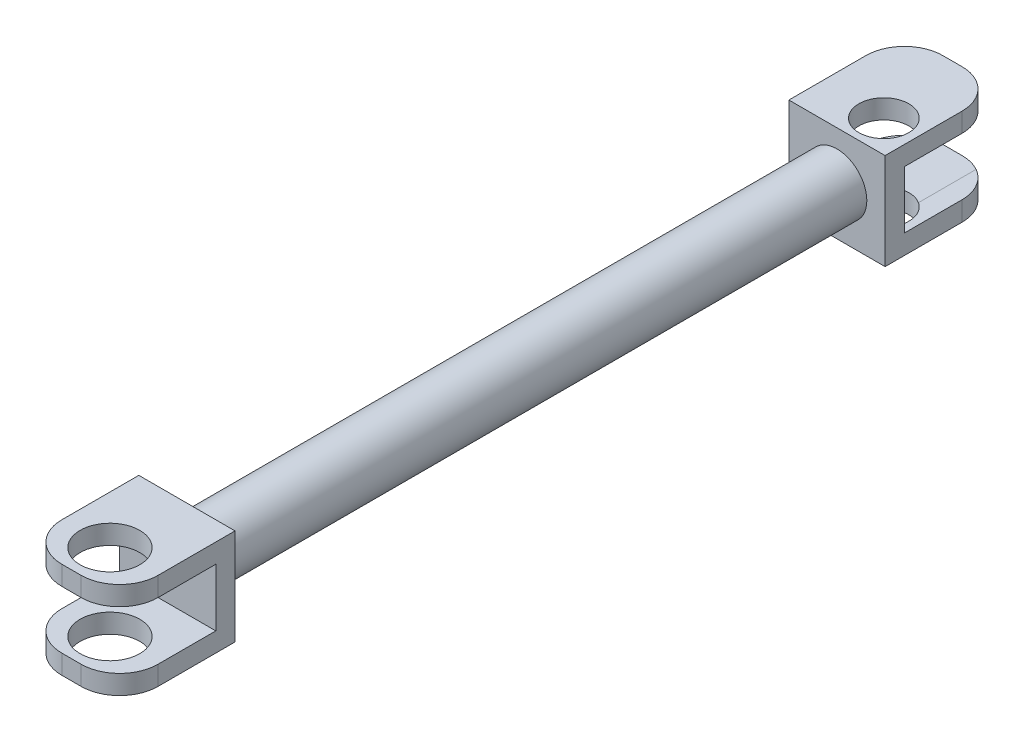
from build123d import *

# Parameters (mm, degrees)
SKETCH1_W             = 50
SKETCH1_H             = 50
BOSS_EXTRUDE1_DEPTH   = 10
BOSS_EXTRUDE1_2_DEPTH = 10
BOSS_EXTRUDE2_DEPTH   = 50
SKETCH3_W             = 30
SKETCH3_H             = 30
CUT_EXTRUDE1_DEPTH    = 90
SKETCH4_W             = 10
SKETCH4_H             = 29.860616381
SKETCH4_H_2           = 30
CUT_EXTRUDE2_DEPTH    = 90
SKETCH5_W             = 50
SKETCH5_H             = 50
BOSS_EXTRUDE3_DEPTH   = 10
SKETCH6_R             = 12
CUT_EXTRUDE3_DEPTH    = 80
SKETCH13_W            = 50
SKETCH13_H            = 50
CUT_EXTRUDE5_DEPTH    = 160
BOSS_EXTRUDE4_DEPTH   = 337.81
SKETCH14_W            = 50
SKETCH14_H            = 50
BOSS_EXTRUDE5_DEPTH   = 10
BOSS_EXTRUDE6_DEPTH   = 10
BOSS_EXTRUDE7_DEPTH   = 10
SKETCH17_R            = 15.5
CUT_EXTRUDE6_DEPTH    = 70
SKETCH19_R            = 12.7
CUT_EXTRUDE7_DEPTH    = 70
SKETCH20_R            = 12.7
BOSS_EXTRUDE11_DEPTH  = 10
SKETCH26_R            = 12
BOSS_EXTRUDE12_DEPTH  = 10
SKETCH27_R            = 13
CUT_EXTRUDE8_DEPTH    = 70


with BuildPart() as part:
    # Sketch1 → Boss-Extrude1 (new body)
    with BuildSketch(Plane.XY):
        with Locations((25, 25)):
            Rectangle(SKETCH1_W, SKETCH1_H)
    extrude(amount=BOSS_EXTRUDE1_DEPTH)

    # Sketch2 → Boss-Extrude2 (add)
    with BuildSketch(Plane(origin=(0, 0, 0), x_dir=(1, 0, 0), z_dir=(0, 1, 0))):
        with BuildLine():
            Line((0, 0), (50, 0))
            Line((50, 0), (50, 30))
            ThreePointArc((50, 30), (44.142135624, 44.142135624), (30, 50))
            Line((30, 50), (20, 50))
            ThreePointArc((20, 50), (5.857864376, 44.142135624), (0, 30))
            Line((0, 30), (0, 0))
        make_face()
    extrude(amount=BOSS_EXTRUDE2_DEPTH)

    # Sketch3 → Cut-Extrude1 (cut)
    with BuildSketch(Plane.XY.offset(10)):
        with Locations((25, 25)):
            Rectangle(SKETCH3_W, SKETCH3_H)
    extrude(amount=-CUT_EXTRUDE1_DEPTH, mode=Mode.SUBTRACT)

    # Sketch4 → Cut-Extrude2 (cut)
    with BuildSketch(Plane.XY.offset(10)):
        with Locations((45, 25.06969181)):
            Rectangle(SKETCH4_W, SKETCH4_H)
        with Locations((5, 25)):
            Rectangle(SKETCH4_W, SKETCH4_H_2)
    extrude(amount=-CUT_EXTRUDE2_DEPTH, mode=Mode.SUBTRACT)


with BuildPart() as body_2:
    # Sketch1 → Boss-Extrude1 2 (new body)
    with BuildSketch(Plane.XY):
        with Locations((25, -320)):
            Rectangle(SKETCH1_W, SKETCH1_H)
    extrude(amount=BOSS_EXTRUDE1_2_DEPTH)

    # Sketch13 → Cut-Extrude5 (cut)
    with BuildSketch(Plane(origin=(0, 0, 0), x_dir=(-1, 0, 0), z_dir=(0, 0, -1))):
        with Locations((-25, -320)):
            Rectangle(SKETCH13_W, SKETCH13_H)
    extrude(amount=-CUT_EXTRUDE5_DEPTH, mode=Mode.SUBTRACT)


with BuildPart() as cut_extrude2_piece_1:
    # of the separate pieces the step leaves, piece 1, a body of its own (cut_extrude2_pieces)
    add(part.part.solids().sort_by_distance((0, 0, 10))[0])



with BuildPart() as cut_extrude2_piece_2:
    # of the separate pieces the step leaves, piece 2, a body of its own (cut_extrude2_pieces)
    add(part.part.solids().sort_by_distance((0, 50, 10))[0])


with BuildPart() as cut_extrude2_piece_1_1:
    add(cut_extrude2_piece_1.part)

    add(cut_extrude2_piece_2.part)  # Boss-Extrude3 merges Cut-Extrude2 piece 2
    # Sketch5 → Boss-Extrude3 (add)
    with BuildSketch(Plane.XY.offset(10)):
        with Locations((25, 25)):
            Rectangle(SKETCH5_W, SKETCH5_H)
    extrude(amount=-BOSS_EXTRUDE3_DEPTH)

    # Sketch6 → Cut-Extrude3 (cut)
    with BuildSketch(Plane.XZ):
        with Locations((25, -30)):
            Circle(SKETCH6_R)
    extrude(amount=-CUT_EXTRUDE3_DEPTH, mode=Mode.SUBTRACT)

    # Sketch7 → Boss-Extrude4 (add)
    with BuildSketch(Plane.XY.offset(10)):
        with BuildLine():
            ThreePointArc((25, 40.5), (14.039844892, 14.039844892), (40.5, 25))
            ThreePointArc((40.5, 25), (35.960155108, 35.960155108), (25, 40.5))
        make_face()
    extrude(amount=BOSS_EXTRUDE4_DEPTH)

    # Sketch14 → Boss-Extrude5 (add)
    with BuildSketch(Plane.XY.offset(347.81)):
        with Locations((25, 25)):
            Rectangle(SKETCH14_W, SKETCH14_H)
    extrude(amount=BOSS_EXTRUDE5_DEPTH)

    # Sketch15 → Boss-Extrude6 (add)
    with BuildSketch(Plane(origin=(0, 50, 0), x_dir=(1, 0, 0), z_dir=(0, 1, 0))):
        with BuildLine():
            Line((0, -357.81), (50, -357.81))
            Line((50, -357.81), (50, -387.81))
            ThreePointArc((50, -387.81), (44.142135624, -401.952135624), (30, -407.81))
            Line((30, -407.81), (20, -407.81))
            ThreePointArc((20, -407.81), (5.857864376, -401.952135624), (0, -387.81))
            Line((0, -387.81), (0, -357.81))
        make_face()
    extrude(amount=-BOSS_EXTRUDE6_DEPTH)

    # Sketch16 → Boss-Extrude7 (add)
    with BuildSketch(Plane.XZ):
        with BuildLine():
            Line((0, 347.81), (50, 347.81))
            Line((50, 347.81), (50, 387.81))
            ThreePointArc((50, 387.81), (44.142135624, 401.952135624), (30, 407.81))
            Line((30, 407.81), (20, 407.81))
            ThreePointArc((20, 407.81), (5.857864376, 401.952135624), (0, 387.81))
            Line((0, 387.81), (0, 347.81))
        make_face()
    extrude(amount=-BOSS_EXTRUDE7_DEPTH)

    # Sketch17 → Cut-Extrude6 (cut)
    with BuildSketch(Plane.XZ):
        with Locations((25, 387.81)):
            Circle(SKETCH17_R)
    extrude(amount=-CUT_EXTRUDE6_DEPTH, mode=Mode.SUBTRACT)

    # Sketch19 → Cut-Extrude7 (cut)
    with BuildSketch(Plane.XZ):
        with Locations((32.852399557, -6.497982337)):
            Circle(SKETCH19_R)
    extrude(amount=-CUT_EXTRUDE7_DEPTH, mode=Mode.SUBTRACT)

    # Sketch20 → Boss-Extrude11 (add)
    with BuildSketch(Plane.XZ):
        with Locations((25, -30)):
            Circle(SKETCH20_R)
    extrude(amount=-BOSS_EXTRUDE11_DEPTH)

    # Sketch26 → Boss-Extrude12 (add)
    with BuildSketch(Plane(origin=(0, 50, 0), x_dir=(1, 0, 0), z_dir=(0, 1, 0))):
        with Locations((25, 30)):
            Circle(SKETCH26_R)
    extrude(amount=-BOSS_EXTRUDE12_DEPTH)

    # Sketch27 → Cut-Extrude8 (cut)
    with BuildSketch(Plane(origin=(0, 50, 0), x_dir=(1, 0, 0), z_dir=(0, 1, 0))):
        with Locations((32.852399557, 6.497982337)):
            Circle(SKETCH27_R)
    extrude(amount=-CUT_EXTRUDE8_DEPTH, mode=Mode.SUBTRACT)


solid = cut_extrude2_piece_1_1.part
